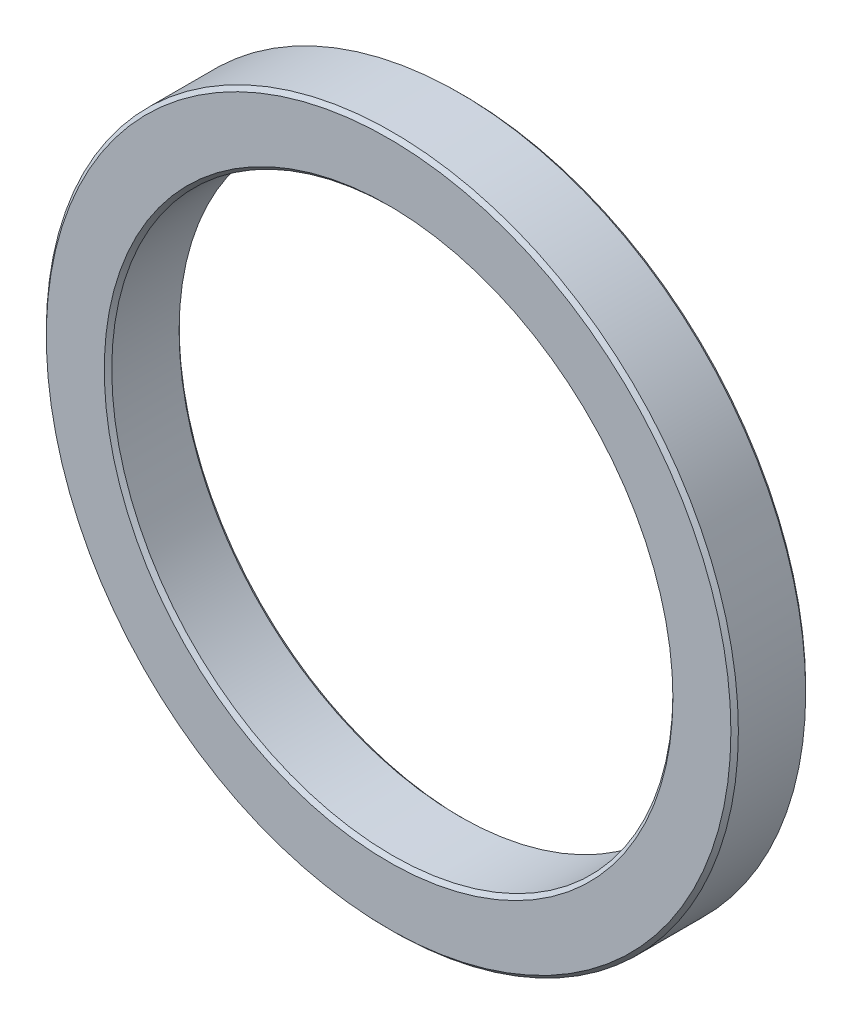
from build123d import *

# Parameters (mm, degrees)
SKETCH_1_R      = 18.5
SKETCH_1_R_2    = 15
EXTRUDE_1_DEPTH = 4
CHAMFER_1_SIZE  = 0.2


with BuildPart() as part:
    # 草图1 → 凸台-拉伸1 (new body)
    with BuildSketch(Plane.XY):
        Circle(SKETCH_1_R)
        Circle(SKETCH_1_R_2, mode=Mode.SUBTRACT)
    extrude(amount=EXTRUDE_1_DEPTH)

    # 倒角1
    chamfer_1_edges = [part.edges().sort_by_distance(p)[0] for p in [
        (-18.5, 0, 0),
        (-18.5, 0, 4),
        (-15, 0, 0),
        (-15, 0, 4),
    ]]
    chamfer(chamfer_1_edges, length=CHAMFER_1_SIZE)


solid = part.part
